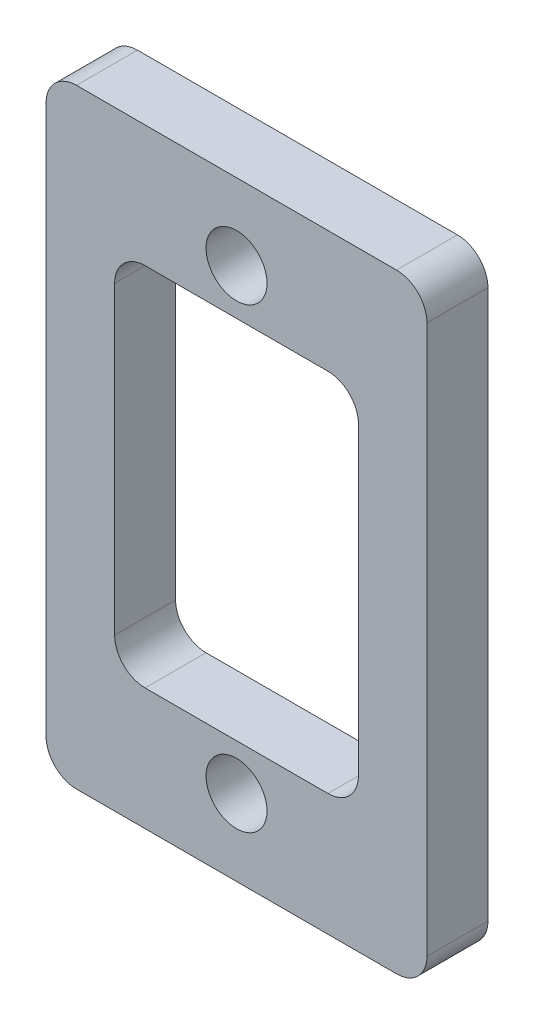
from build123d import *

# Parameters (mm, degrees)
SKETCH_1_W          = 25
SKETCH_1_H          = 40
EXTRUDE_1_DEPTH     = 4
SKETCH_2_R          = 2
CUT_EXTRUDE_1_DEPTH = 10
FILLET_1_R          = 2
SKETCH_3_W          = 16
SKETCH_3_H          = 24
CUT_EXTRUDE_2_DEPTH = 10
FILLET_2_R          = 2


with BuildPart() as part:
    # 草图1 → 凸台-拉伸1 (new body)
    with BuildSketch(Plane.XY):
        Rectangle(SKETCH_1_W, SKETCH_1_H)
    extrude(amount=EXTRUDE_1_DEPTH)

    # 草图2 → 切除-拉伸1 (cut)
    with BuildSketch(Plane.XY.offset(4)):
        with Locations((0, 15)):
            Circle(SKETCH_2_R)
        with Locations((0, -15)):
            Circle(SKETCH_2_R)
    extrude(amount=-CUT_EXTRUDE_1_DEPTH, mode=Mode.SUBTRACT)

    # 圆角1
    fillet_1_edges = [part.edges().sort_by_distance(p)[0] for p in [
        (12.5, -20, 2),
        (-12.5, -20, 2),
        (-12.5, 20, 2),
        (12.5, 20, 2),
    ]]
    fillet(fillet_1_edges, radius=FILLET_1_R)

    # 草图3 → 切除-拉伸2 (cut)
    with BuildSketch(Plane.XY.offset(4)):
        Rectangle(SKETCH_3_W, SKETCH_3_H)
    extrude(amount=-CUT_EXTRUDE_2_DEPTH, mode=Mode.SUBTRACT)

    # 圆角2
    fillet_2_edges = [part.edges().sort_by_distance(p)[0] for p in [
        (8, 12, 2),
        (8, -12, 2),
        (-8, -12, 2),
        (-8, 12, 2),
    ]]
    fillet(fillet_2_edges, radius=FILLET_2_R)


solid = part.part
